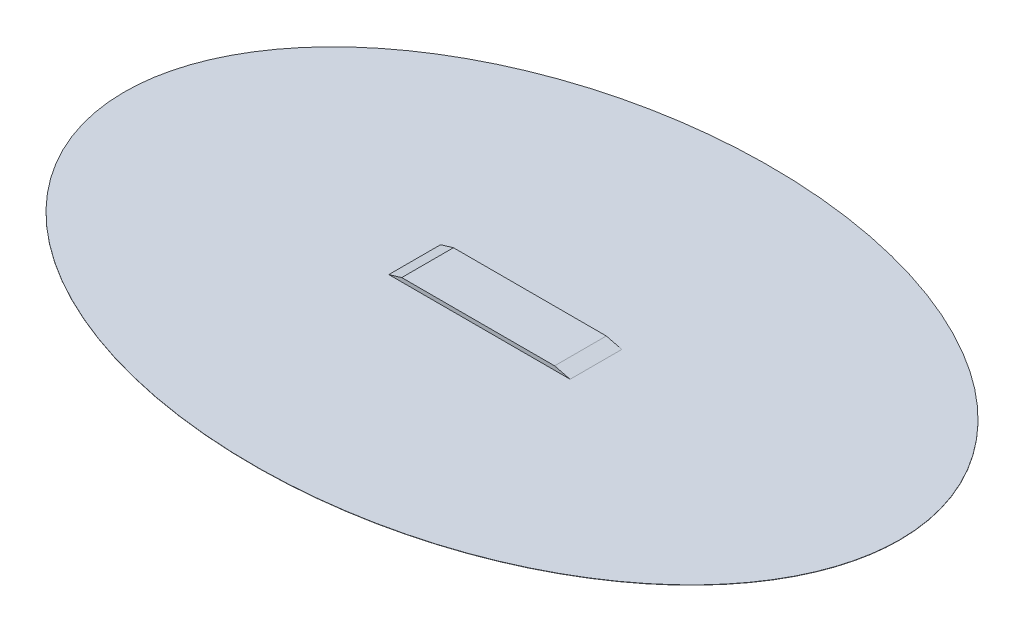
from build123d import *

# Parameters (mm, degrees)
SKETCH_1_RX          = 15000
SKETCH_1_RY          = 10000
EXTRUDE_1_DEPTH      = 10
EXTRUDE_2_DEPTH      = 1000
EXTRUDE_2_DEPTH_BACK = 1000


with BuildPart() as part:
    # 草图1 → 凸台-拉伸1 (new body)
    with BuildSketch(Plane(origin=(0, 0, 0), x_dir=(1, 0, 0), z_dir=(0, 1, 0))):
        with Locations((0, 0)):
            Ellipse(SKETCH_1_RX, SKETCH_1_RY)
    extrude(amount=EXTRUDE_1_DEPTH)

    # 草图4 → 凸台-拉伸2 (add, two sides: drawn at the far end of the back side and taken through both)
    with BuildSketch(Plane.XY.offset(-EXTRUDE_2_DEPTH_BACK)):
        Polygon((-3765.653062208, 10), (-3265.653062208, 160), (2647.580583315, 160), (3247.580583315, 10), align=None)
    extrude(amount=EXTRUDE_2_DEPTH + EXTRUDE_2_DEPTH_BACK)


solid = part.part
